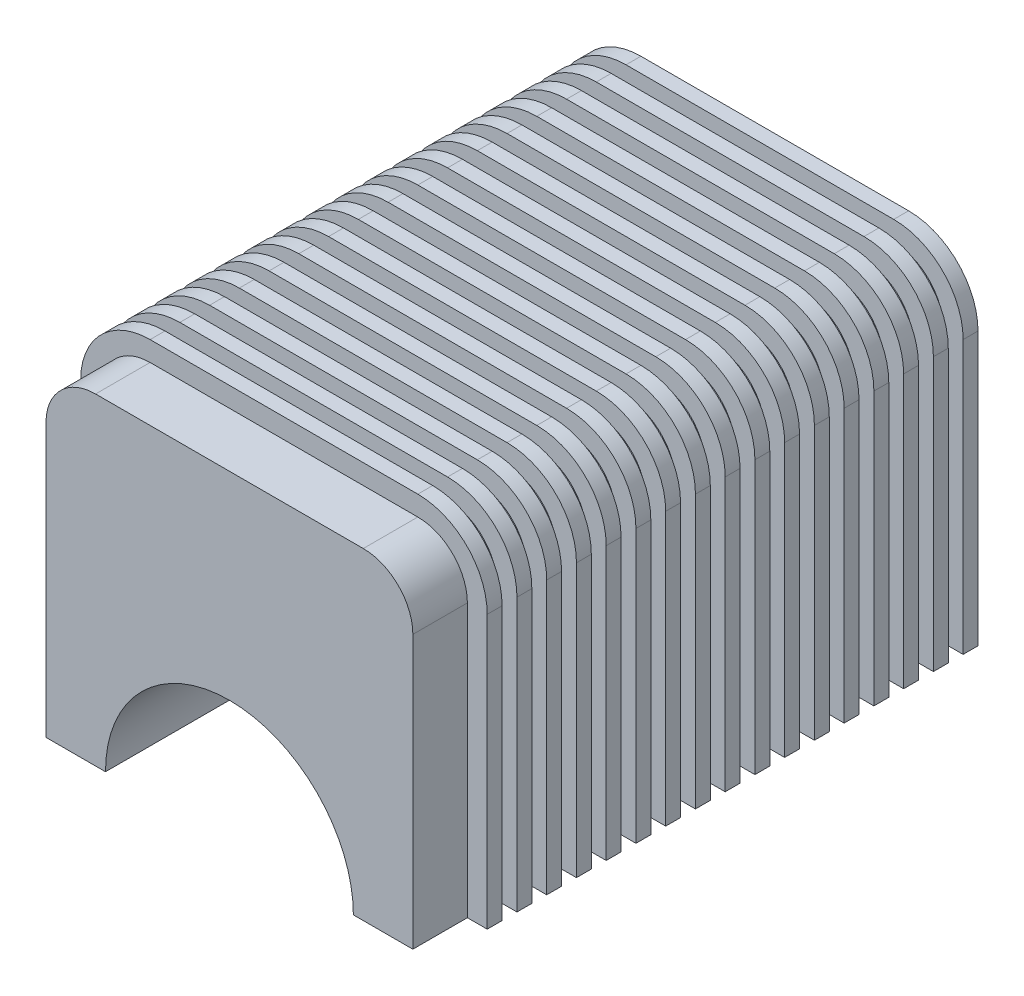
from build123d import *

# Parameters (mm, degrees)
BOSS_EXTRUDE1_DEPTH = 110
BOSS_EXTRUDE2_DEPTH = 3
LPATTERN1_COUNT     = 17
LPATTERN1_PITCH     = 6


with BuildPart() as part:
    # Sketch1 → Boss-Extrude1 (new body)
    with BuildSketch(Plane.XY):
        with BuildLine():
            Line((25, 0), (37, 0))
            Line((37, 0), (37, 55))
            ThreePointArc((37, 55), (34.071067812, 62.071067812), (27, 65))
            Line((27, 65), (-27, 65))
            ThreePointArc((-27, 65), (-34.071067812, 62.071067812), (-37, 55))
            Line((-37, 55), (-37, 0))
            Line((-37, 0), (-25, 0))
            ThreePointArc((-25, 0), (0, 25), (25, 0))
        make_face()
    extrude(amount=BOSS_EXTRUDE1_DEPTH)

    # Sketch2 → Boss-Extrude2 (add)
    with BuildSketch(Plane(origin=(0, 0, 0), x_dir=(-1, 0, 0), z_dir=(0, 0, -1))):
        with BuildLine():
            Line((41, 0), (41, 55))
            ThreePointArc((41, 55), (36.899494937, 64.899494937), (27, 69))
            Line((27, 69), (-27, 69))
            ThreePointArc((-27, 69), (-36.899494937, 64.899494937), (-41, 55))
            Line((-41, 55), (-41, 0))
            Line((-41, 0), (-37, 0))
            Line((-37, 0), (-25, 0))
            ThreePointArc((-25, 0), (0, 25), (25, 0))
            Line((25, 0), (37, 0))
            Line((37, 0), (41, 0))
        make_face()
    boss_extrude2 = extrude(amount=-BOSS_EXTRUDE2_DEPTH)

    # LPattern1: Boss-Extrude2 ×17
    with Locations(*[(0, 0, i * LPATTERN1_PITCH) for i in range(1, LPATTERN1_COUNT)]):
        add(boss_extrude2)


solid = part.part
